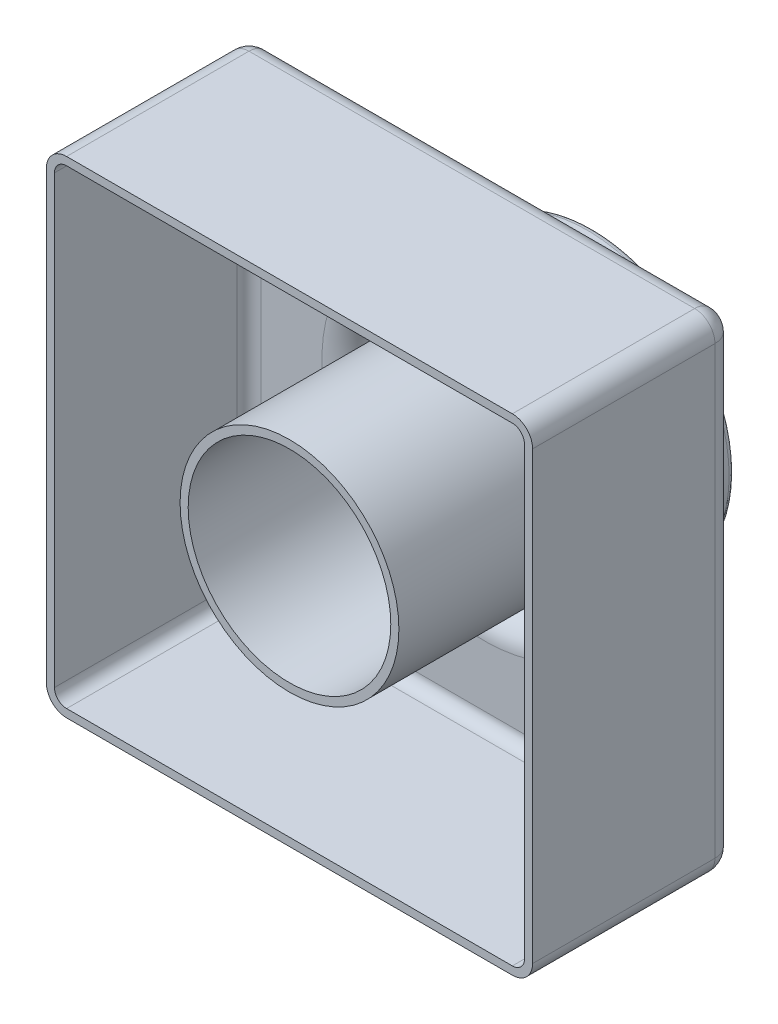
from build123d import *

# Parameters (mm, degrees)
SKETCH1_W           = 120
SKETCH1_H           = 120
BOSS_EXTRUDE1_DEPTH = 50
SKETCH2_R           = 35
BOSS_EXTRUDE3_DEPTH = 25
SKETCH5_R           = 25
CUT_EXTRUDE1_DEPTH  = 186.539753153
FILLET1_R           = 5
FILLET2_R           = 5
FILLET3_R           = 1.5
FILLET4_R           = 5
SHELL1_T            = -2


with BuildPart() as part:
    # Sketch1 → Boss-Extrude1 (new body)
    with BuildSketch(Plane.XY):
        with Locations((60, -60)):
            Rectangle(SKETCH1_W, SKETCH1_H)
    extrude(amount=BOSS_EXTRUDE1_DEPTH)

    # Sketch2 → Boss-Extrude3 (add)
    with BuildSketch(Plane.XY):
        with Locations((60, -60)):
            Circle(SKETCH2_R)
    extrude(amount=-BOSS_EXTRUDE3_DEPTH)

    # Sketch5 → Cut-Extrude1 (cut, through all)
    with BuildSketch(Plane(origin=(0, 0, -25), x_dir=(-1, 0, 0), z_dir=(0, 0, -1))):
        with Locations((-60, -60)):
            Circle(SKETCH5_R)
    extrude(amount=-CUT_EXTRUDE1_DEPTH, mode=Mode.SUBTRACT)

    # Fillet1
    fillet1_edges = [part.edges().sort_by_distance(p)[0] for p in [
        (0, 0, 25),
        (0, -120, 25),
        (120, -120, 25),
        (120, 0, 25),
    ]]
    fillet(fillet1_edges, radius=FILLET1_R)

    # Fillet2
    fillet2_edges = [part.edges().sort_by_distance(p)[0] for p in [
        (25, -60, 0),
    ]]
    fillet(fillet2_edges, radius=FILLET2_R)

    # Fillet3
    fillet3_edges = [part.edges().sort_by_distance(p)[0] for p in [
        (25, -60, -25),
        (85, -60, -25),
    ]]
    fillet(fillet3_edges, radius=FILLET3_R)

    # Fillet4
    fillet4_edges = [part.edges().sort_by_distance(p)[0] for p in [
        (1.464466094, -118.535533906, 0),
        (60, -120, 0),
        (118.535533906, -118.535533906, 0),
        (120, -60, 0),
        (118.535533906, -1.464466094, 0),
        (60, 0, 0),
        (1.464466094, -1.464466094, 0),
        (0, -60, 0),
    ]]
    fillet(fillet4_edges, radius=FILLET4_R)

    # Shell1
    shell1_openings = [part.faces().sort_by_distance(p)[0] for p in [
        (60, -1.697056275, 50),
    ]]
    offset(amount=SHELL1_T, openings=shell1_openings, kind=Kind.INTERSECTION)


solid = part.part
